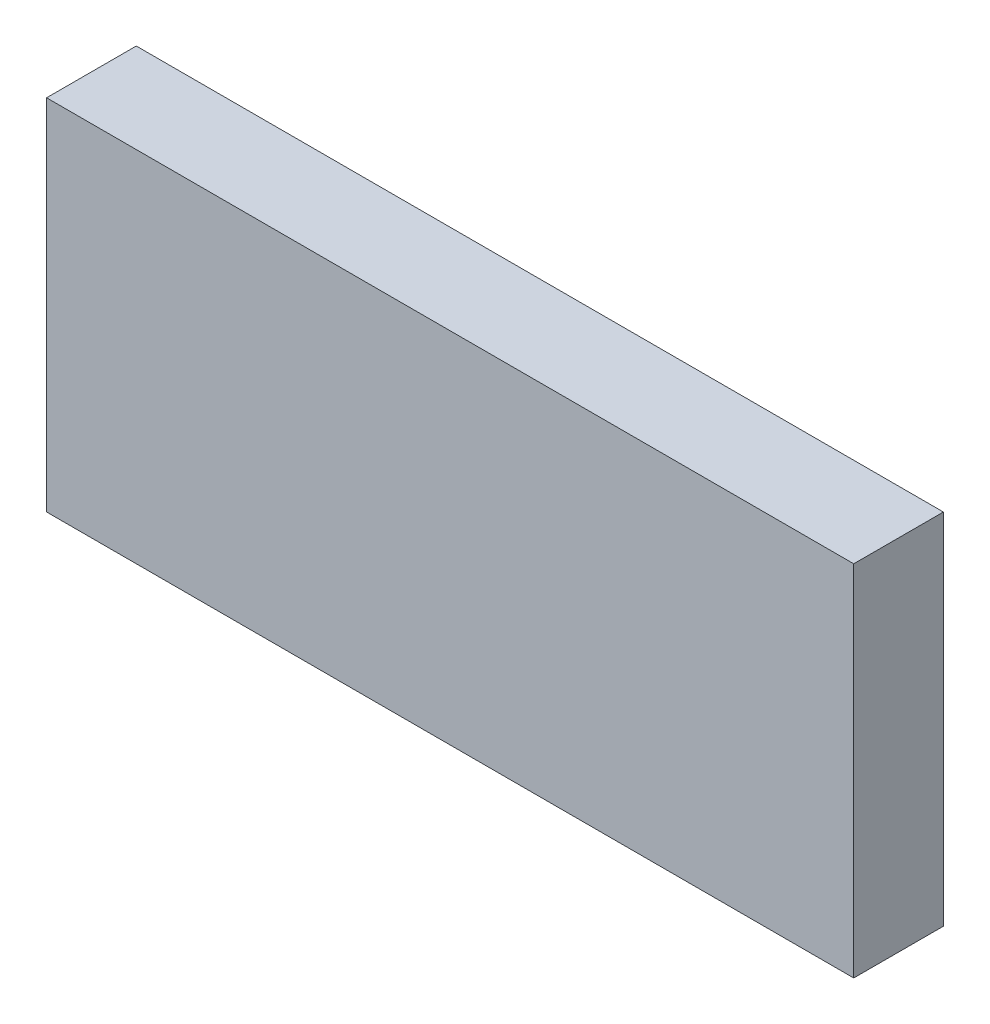
from build123d import *

# Parameters (mm, degrees)
SKETCH1_W           = 85.725
SKETCH1_H           = 38.1
BOSS_EXTRUDE1_DEPTH = 9.525


with BuildPart() as part:
    # Sketch1 → Boss-Extrude1 (new body)
    with BuildSketch(Plane.XY):
        Rectangle(SKETCH1_W, SKETCH1_H)
    extrude(amount=BOSS_EXTRUDE1_DEPTH)


solid = part.part
